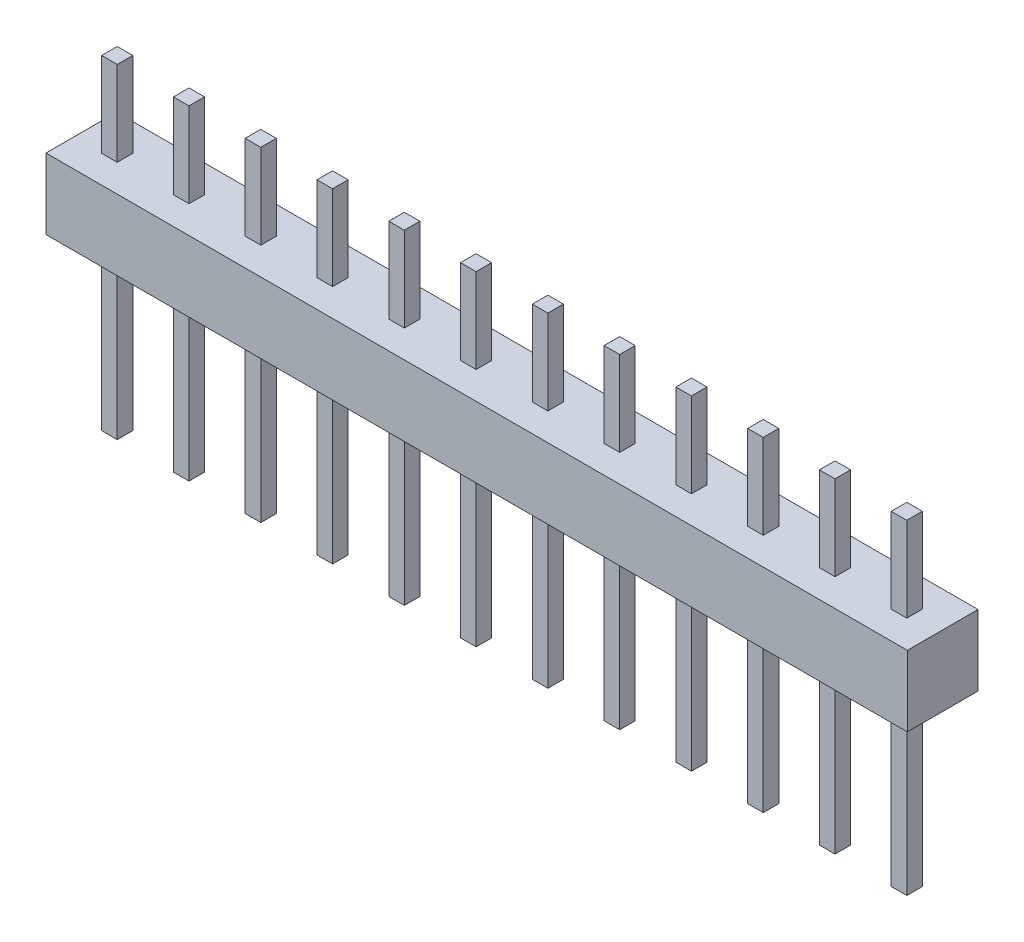
from build123d import *

# Parameters (mm, degrees)
SKETCH1_W              = 30.48
SKETCH1_H              = 2.5
BOSS_EXTRUDE1_DEPTH    = 1.25
SKETCH2_W              = 0.55
SKETCH2_H              = 0.55
BOSS_EXTRUDE2_DEPTH    = 6
BOSS_EXTRUDE2_2_DEPTH  = 6
BOSS_EXTRUDE2_3_DEPTH  = 6
BOSS_EXTRUDE2_4_DEPTH  = 6
BOSS_EXTRUDE2_5_DEPTH  = 6
BOSS_EXTRUDE2_6_DEPTH  = 6
BOSS_EXTRUDE2_7_DEPTH  = 6
BOSS_EXTRUDE2_8_DEPTH  = 6
BOSS_EXTRUDE2_9_DEPTH  = 6
BOSS_EXTRUDE2_10_DEPTH = 6
BOSS_EXTRUDE2_11_DEPTH = 6
BOSS_EXTRUDE2_12_DEPTH = 6
SKETCH2_2_W            = 0.55
SKETCH2_2_H            = 0.55
BOSS_EXTRUDE3_DEPTH    = 5.5
BOSS_EXTRUDE3_2_DEPTH  = 5.5
BOSS_EXTRUDE3_3_DEPTH  = 5.5
BOSS_EXTRUDE3_4_DEPTH  = 5.5
BOSS_EXTRUDE3_5_DEPTH  = 5.5
BOSS_EXTRUDE3_6_DEPTH  = 5.5
BOSS_EXTRUDE3_7_DEPTH  = 5.5
BOSS_EXTRUDE3_8_DEPTH  = 5.5
BOSS_EXTRUDE3_9_DEPTH  = 5.5
BOSS_EXTRUDE3_10_DEPTH = 5.5
BOSS_EXTRUDE3_11_DEPTH = 5.5
BOSS_EXTRUDE3_12_DEPTH = 5.5


with BuildPart() as part:
    # Sketch1 → Boss-Extrude1 (new, symmetric)
    with BuildSketch(Plane.XY):
        with Locations((15.24, 1.25)):
            Rectangle(SKETCH1_W, SKETCH1_H)
    extrude(amount=BOSS_EXTRUDE1_DEPTH, both=True)


with BuildPart() as body_2:
    # Sketch2 → Boss-Extrude2 (new body)
    with BuildSketch(Plane.XZ):
        with Locations((3.81, 0)):
            Rectangle(SKETCH2_W, SKETCH2_H)
    extrude(amount=BOSS_EXTRUDE2_DEPTH)


with BuildPart() as body_3:
    # Sketch2 → Boss-Extrude2 2 (new body)
    with BuildSketch(Plane.XZ):
        with Locations((1.27, 0)):
            Rectangle(SKETCH2_W, SKETCH2_H)
    extrude(amount=BOSS_EXTRUDE2_2_DEPTH)


with BuildPart() as body_4:
    # Sketch2 → Boss-Extrude2 3 (new body)
    with BuildSketch(Plane.XZ):
        with Locations((6.35, 0)):
            Rectangle(SKETCH2_W, SKETCH2_H)
    extrude(amount=BOSS_EXTRUDE2_3_DEPTH)


with BuildPart() as body_5:
    # Sketch2 → Boss-Extrude2 4 (new body)
    with BuildSketch(Plane.XZ):
        with Locations((8.89, 0)):
            Rectangle(SKETCH2_W, SKETCH2_H)
    extrude(amount=BOSS_EXTRUDE2_4_DEPTH)


with BuildPart() as body_6:
    # Sketch2 → Boss-Extrude2 5 (new body)
    with BuildSketch(Plane.XZ):
        with Locations((11.43, 0)):
            Rectangle(SKETCH2_W, SKETCH2_H)
    extrude(amount=BOSS_EXTRUDE2_5_DEPTH)


with BuildPart() as body_7:
    # Sketch2 → Boss-Extrude2 6 (new body)
    with BuildSketch(Plane.XZ):
        with Locations((13.97, 0)):
            Rectangle(SKETCH2_W, SKETCH2_H)
    extrude(amount=BOSS_EXTRUDE2_6_DEPTH)


with BuildPart() as body_8:
    # Sketch2 → Boss-Extrude2 7 (new body)
    with BuildSketch(Plane.XZ):
        with Locations((16.51, 0)):
            Rectangle(SKETCH2_W, SKETCH2_H)
    extrude(amount=BOSS_EXTRUDE2_7_DEPTH)


with BuildPart() as body_9:
    # Sketch2 → Boss-Extrude2 8 (new body)
    with BuildSketch(Plane.XZ):
        with Locations((19.05, 0)):
            Rectangle(SKETCH2_W, SKETCH2_H)
    extrude(amount=BOSS_EXTRUDE2_8_DEPTH)


with BuildPart() as body_10:
    # Sketch2 → Boss-Extrude2 9 (new body)
    with BuildSketch(Plane.XZ):
        with Locations((21.59, 0)):
            Rectangle(SKETCH2_W, SKETCH2_H)
    extrude(amount=BOSS_EXTRUDE2_9_DEPTH)


with BuildPart() as body_11:
    # Sketch2 → Boss-Extrude2 10 (new body)
    with BuildSketch(Plane.XZ):
        with Locations((24.13, 0)):
            Rectangle(SKETCH2_W, SKETCH2_H)
    extrude(amount=BOSS_EXTRUDE2_10_DEPTH)


with BuildPart() as body_12:
    # Sketch2 → Boss-Extrude2 11 (new body)
    with BuildSketch(Plane.XZ):
        with Locations((26.67, 0)):
            Rectangle(SKETCH2_W, SKETCH2_H)
    extrude(amount=BOSS_EXTRUDE2_11_DEPTH)


with BuildPart() as body_13:
    # Sketch2 → Boss-Extrude2 12 (new body)
    with BuildSketch(Plane.XZ):
        with Locations((29.21, 0)):
            Rectangle(SKETCH2_W, SKETCH2_H)
    extrude(amount=BOSS_EXTRUDE2_12_DEPTH)


with BuildPart() as body_14:
    # Sketch2<2> → Boss-Extrude3 (new body)
    with BuildSketch(Plane.XZ):
        with Locations((3.81, 0)):
            Rectangle(SKETCH2_2_W, SKETCH2_2_H)
    extrude(amount=-BOSS_EXTRUDE3_DEPTH)


with BuildPart() as body_15:
    # Sketch2<2> → Boss-Extrude3 2 (new body)
    with BuildSketch(Plane.XZ):
        with Locations((1.27, 0)):
            Rectangle(SKETCH2_2_W, SKETCH2_2_H)
    extrude(amount=-BOSS_EXTRUDE3_2_DEPTH)


with BuildPart() as body_16:
    # Sketch2<2> → Boss-Extrude3 3 (new body)
    with BuildSketch(Plane.XZ):
        with Locations((6.35, 0)):
            Rectangle(SKETCH2_2_W, SKETCH2_2_H)
    extrude(amount=-BOSS_EXTRUDE3_3_DEPTH)


with BuildPart() as body_17:
    # Sketch2<2> → Boss-Extrude3 4 (new body)
    with BuildSketch(Plane.XZ):
        with Locations((8.89, 0)):
            Rectangle(SKETCH2_2_W, SKETCH2_2_H)
    extrude(amount=-BOSS_EXTRUDE3_4_DEPTH)


with BuildPart() as body_18:
    # Sketch2<2> → Boss-Extrude3 5 (new body)
    with BuildSketch(Plane.XZ):
        with Locations((11.43, 0)):
            Rectangle(SKETCH2_2_W, SKETCH2_2_H)
    extrude(amount=-BOSS_EXTRUDE3_5_DEPTH)


with BuildPart() as body_19:
    # Sketch2<2> → Boss-Extrude3 6 (new body)
    with BuildSketch(Plane.XZ):
        with Locations((13.97, 0)):
            Rectangle(SKETCH2_2_W, SKETCH2_2_H)
    extrude(amount=-BOSS_EXTRUDE3_6_DEPTH)


with BuildPart() as body_20:
    # Sketch2<2> → Boss-Extrude3 7 (new body)
    with BuildSketch(Plane.XZ):
        with Locations((16.51, 0)):
            Rectangle(SKETCH2_2_W, SKETCH2_2_H)
    extrude(amount=-BOSS_EXTRUDE3_7_DEPTH)


with BuildPart() as body_21:
    # Sketch2<2> → Boss-Extrude3 8 (new body)
    with BuildSketch(Plane.XZ):
        with Locations((19.05, 0)):
            Rectangle(SKETCH2_2_W, SKETCH2_2_H)
    extrude(amount=-BOSS_EXTRUDE3_8_DEPTH)


with BuildPart() as body_22:
    # Sketch2<2> → Boss-Extrude3 9 (new body)
    with BuildSketch(Plane.XZ):
        with Locations((21.59, 0)):
            Rectangle(SKETCH2_2_W, SKETCH2_2_H)
    extrude(amount=-BOSS_EXTRUDE3_9_DEPTH)


with BuildPart() as body_23:
    # Sketch2<2> → Boss-Extrude3 10 (new body)
    with BuildSketch(Plane.XZ):
        with Locations((24.13, 0)):
            Rectangle(SKETCH2_2_W, SKETCH2_2_H)
    extrude(amount=-BOSS_EXTRUDE3_10_DEPTH)


with BuildPart() as body_24:
    # Sketch2<2> → Boss-Extrude3 11 (new body)
    with BuildSketch(Plane.XZ):
        with Locations((26.67, 0)):
            Rectangle(SKETCH2_2_W, SKETCH2_2_H)
    extrude(amount=-BOSS_EXTRUDE3_11_DEPTH)


with BuildPart() as body_25:
    # Sketch2<2> → Boss-Extrude3 12 (new body)
    with BuildSketch(Plane.XZ):
        with Locations((29.21, 0)):
            Rectangle(SKETCH2_2_W, SKETCH2_2_H)
    extrude(amount=-BOSS_EXTRUDE3_12_DEPTH)


solid = Compound([part.part, body_2.part, body_3.part, body_4.part, body_5.part, body_6.part, body_7.part, body_8.part, body_9.part, body_10.part, body_11.part, body_12.part, body_13.part, body_14.part, body_15.part, body_16.part, body_17.part, body_18.part, body_19.part, body_20.part, body_21.part, body_22.part, body_23.part, body_24.part, body_25.part])
